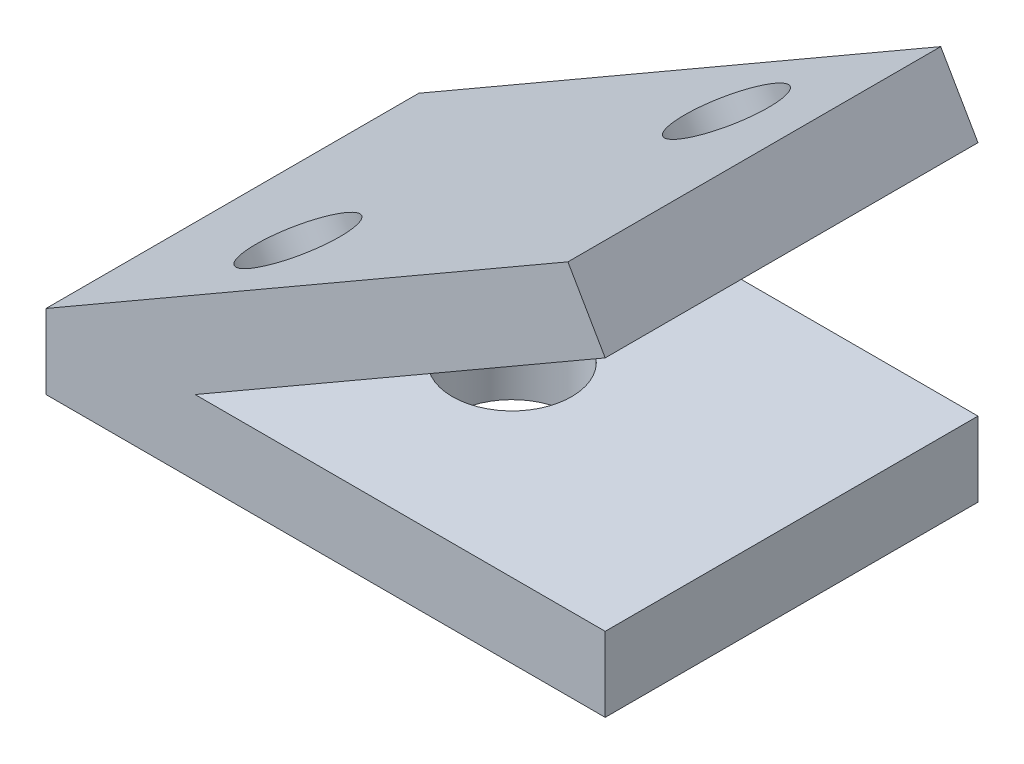
from build123d import *

# Parameters (mm, degrees)
SKETCH2_W           = 15
SKETCH2_H           = 2
BOSS_EXTRUDE1_DEPTH = 10
BOSS_EXTRUDE2_DEPTH = 10
SKETCH4_R           = 1.3
CUT_EXTRUDE1_DEPTH  = 2
SKETCH5_R           = 1.6
CUT_EXTRUDE2_DEPTH  = 2


with BuildPart() as part:
    # Sketch2 → Boss-Extrude1 (new body)
    with BuildSketch(Plane.XY):
        with Locations((7.5, 1)):
            Rectangle(SKETCH2_W, SKETCH2_H)
    extrude(amount=BOSS_EXTRUDE1_DEPTH)

    # Sketch3 → Boss-Extrude2 (add)
    with BuildSketch(Plane.XY.offset(10)):
        Polygon((0, 2), (4, 2), (15, 8.350852961), (14, 10.082903769), align=None)
    extrude(amount=-BOSS_EXTRUDE2_DEPTH)

    # Sketch4 → Cut-Extrude1 (cut)
    with BuildSketch(Plane(origin=(-0.866025404, 1.5, 0), x_dir=(0.8660254037844378, 0.5000000000000016, 0), z_dir=(-0.5000000000000016, 0.8660254037844378, 0))):
        with Locations(Location((5.915807537, -7.5, 0), (0, 0, 180))):
            Circle(SKETCH4_R)
        with Locations(Location((13.415807537, -2.5, 0), (0, 0, 180))):
            Circle(SKETCH4_R)
    extrude(amount=-CUT_EXTRUDE1_DEPTH, mode=Mode.SUBTRACT)

    # Sketch5 → Cut-Extrude2 (cut)
    with BuildSketch(Plane(origin=(0, 2, 0), x_dir=(1, 0, 0), z_dir=(0, 1, 0))):
        with Locations(Location((7.5, -5, 0), (0, 0, 270))):
            Circle(SKETCH5_R)
    extrude(amount=-CUT_EXTRUDE2_DEPTH, mode=Mode.SUBTRACT)


solid = part.part
